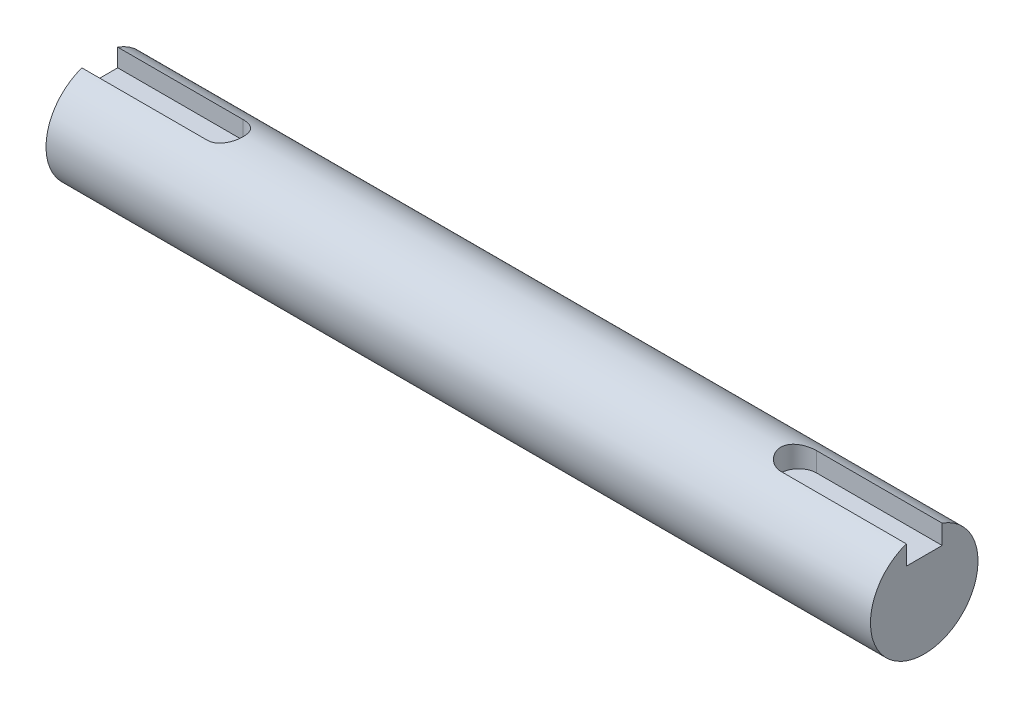
from build123d import *

# Parameters (mm, degrees)
SKETCH1_R           = 7.5
BOSS_EXTRUDE1_DEPTH = 115
CUT_EXTRUDE3_START  = 10
CUT_EXTRUDE3_DEPTH  = 12.5
CUT_EXTRUDE4_START  = 10
CUT_EXTRUDE4_DEPTH  = 12.7


with BuildPart() as part:
    # Sketch1 → Boss-Extrude1 (new body)
    with BuildSketch(Plane(origin=(0, 0, 0), x_dir=(0, 0, -1), z_dir=(1, 0, 0))):
        Circle(SKETCH1_R)
    extrude(amount=BOSS_EXTRUDE1_DEPTH)

    # Sketch8 → Cut-Extrude3 (cut)
    with BuildSketch(Plane(origin=(0, 7.071067812, 0), x_dir=(1, 0, 0), z_dir=(0, 1, 0)).offset(CUT_EXTRUDE3_START)):
        with BuildLine():
            Line((0, 2.5), (17.5, 2.5))
            ThreePointArc((17.5, 2.5), (20, 0), (17.5, -2.5))
            Line((17.5, -2.5), (0, -2.5))
            ThreePointArc((0, -2.5), (-2.5, 0), (0, 2.5))
        make_face()
    extrude(amount=-CUT_EXTRUDE3_DEPTH, mode=Mode.SUBTRACT)

    # Sketch9 → Cut-Extrude4 (cut)
    with BuildSketch(Plane(origin=(0, 7.071067812, 0), x_dir=(1, 0, 0), z_dir=(0, 1, 0)).offset(CUT_EXTRUDE4_START)):
        with BuildLine():
            Line((115, -2.5), (97.5, -2.5))
            ThreePointArc((97.5, -2.5), (95, 0), (97.5, 2.5))
            Line((97.5, 2.5), (115, 2.5))
            ThreePointArc((115, 2.5), (117.5, 0), (115, -2.5))
        make_face()
    extrude(amount=-CUT_EXTRUDE4_DEPTH, mode=Mode.SUBTRACT)


solid = part.part
